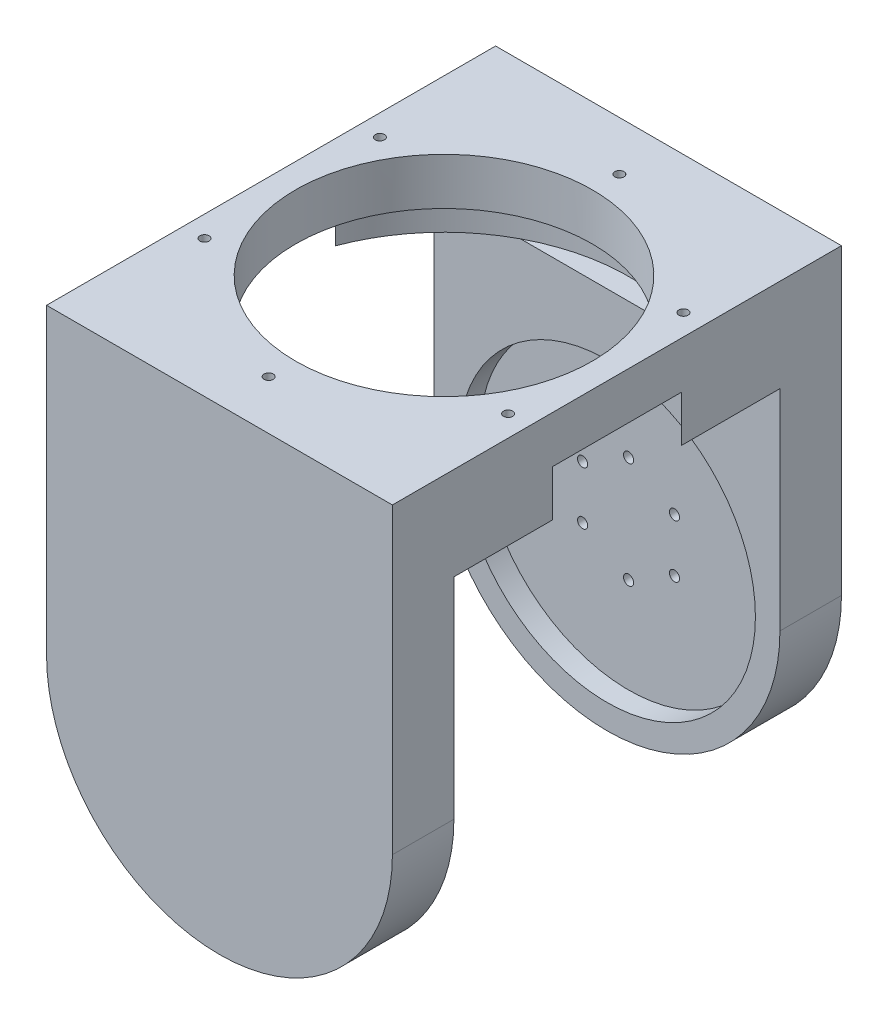
from build123d import *
from build123d.topology import SkipClean

# Parameters (mm, degrees)
SKETCH_1_R                      = 48.25
EXTRUDE_1_DEPTH                 = 20
EXTRUDE_2_DEPTH                 = 66
SKETCH_3_R                      = 48.25
EXTRUDE_3_DEPTH                 = 20
SKETCH_4_R                      = 48.25
CUT_EXTRUDE_1_DEPTH             = 20
SKETCH_5_R                      = 48.25
EXTRUDE_4_DEPTH                 = 20
CUT_EXTRUDE_2_DEPTH             = 20
EXTRUDE_START                   = 20
SKETCH_7_R                      = 48.25
EXTRUDE_5_DEPTH                 = 20
CUT_EXTRUDE_START               = -20
CUT_EXTRUDE_3_DEPTH             = 20
SKETCH_9_R                      = 48.25
EXTRUDE_6_DEPTH                 = 20
EXTRUDE_START_2                 = -20
SKETCH_10_R                     = 48.25
EXTRUDE_7_DEPTH                 = 20
SKETCH_14_R                     = 1.65
EXTRUDE_11_DEPTH                = 10
EXTRUDE_START_3                 = 10
SKETCH_15_R                     = 1.65
EXTRUDE_12_DEPTH                = 10
SKETCH_16_R                     = 27.5
SKETCH_16_R_2                   = 13.104074627
EXTRUDE_13_DEPTH                = 20
CUT_EXTRUDE_4_REACH             = 168.371
SKETCH_17_R                     = 1.65
CUT_EXTRUDE_4_DIRECTION_2_REACH = 168.371
SKETCH_18_R                     = 48.25
CUT_EXTRUDE_5_DEPTH             = 7
CUT_EXTRUDE_6_DEPTH             = 193.775751689
EXTRUDE_START_4                 = 25
SKETCH_20_W                     = 112.445782612
SKETCH_20_H                     = 146
SKETCH_20_R                     = 48.25
EXTRUDE_14_DEPTH                = 25
SKETCH_21_R                     = 60
CUT_EXTRUDE_7_DEPTH             = 15
SKETCH_22_R                     = 1.5
CUT_EXTRUDE_8_DEPTH             = 197.177673484


with BuildPart() as part:
    # 草图1 → 凸台-拉伸1 (new body)
    with BuildSketch(Plane.XY):
        with BuildLine():
            Line((-56.222891306, -36.741813889), (-56.222891306, 36.741813889))
            Line((-56.222891306, 36.741813889), (56.222891306, 36.741813889))
            Line((56.222891306, 36.741813889), (56.222891306, -36.741813889))
            ThreePointArc((56.222891306, -36.741813889), (0, -92.964705195), (-56.222891306, -36.741813889))
        make_face()
        with Locations((0, -36.741813889)):
            Circle(SKETCH_1_R, mode=Mode.SUBTRACT)
    extrude(amount=EXTRUDE_1_DEPTH)

    # 草图2 → 凸台-拉伸2 (add)
    with BuildSketch(Plane.XY.offset(20)):
        Polygon((-43.974846567, 18.741813889), (-56.222891306, 18.741813889), (-56.222891306, 6.493769151), align=None)
        Polygon((56.222891306, 18.741813889), (43.974846567, 18.741813889), (56.222891306, 6.493769151), align=None)
        Polygon((-56.222891306, 36.741813889), (-56.222891306, 18.741813889), (-43.974846567, 18.741813889), (43.974846567, 18.741813889), (56.222891306, 18.741813889), (56.222891306, 36.741813889), align=None)
    extrude(amount=EXTRUDE_2_DEPTH)

    # 草图3 → 凸台-拉伸3 (add)
    with BuildSketch(Plane.XY.offset(86)):
        with BuildLine():
            Line((-56.222891306, 36.741813889), (-56.222891306, -36.741813889))
            ThreePointArc((-56.222891306, -36.741813889), (0, -92.964705195), (56.222891306, -36.741813889))
            Line((56.222891306, -36.741813889), (56.222891306, 36.741813889))
            Line((56.222891306, 36.741813889), (-56.222891306, 36.741813889))
        make_face()
        with Locations((0, -36.741813889)):
            Circle(SKETCH_3_R, mode=Mode.SUBTRACT)
    extrude(amount=EXTRUDE_3_DEPTH)

    # 草图4 → 切除-拉伸1 (cut)
    with BuildSketch(Plane(origin=(0, 36.741813889, 0), x_dir=(1, 0, 0), z_dir=(0, 1, 0))):
        with Locations(Location((0, -53, 0), (0, 0, 270))):
            Circle(SKETCH_4_R)
    extrude(amount=-CUT_EXTRUDE_1_DEPTH, mode=Mode.SUBTRACT)

    # 草图5 → 凸台-拉伸4 (add)
    with BuildSketch(Plane.XY.offset(106)):
        with BuildLine():
            Line((56.222891306, -36.741813889), (56.222891306, 36.741813889))
            Line((56.222891306, 36.741813889), (-56.222891306, 36.741813889))
            Line((-56.222891306, 36.741813889), (-56.222891306, -36.741813889))
            ThreePointArc((-56.222891306, -36.741813889), (0, -92.964705195), (56.222891306, -36.741813889))
        make_face()
        with Locations((0, -36.741813889)):
            Circle(SKETCH_5_R, mode=Mode.SUBTRACT)
    extrude(amount=EXTRUDE_4_DEPTH)

    # 草图6 → 切除-拉伸2 (cut)
    with BuildSketch(Plane(origin=(0, 0, 86), x_dir=(-1, 0, 0), z_dir=(0, 0, -1))):
        with BuildLine():
            Line((35.200319601, 16.741813889), (-35.200319601, 16.741813889))
            Line((-35.200319601, 16.741813889), (-35.200319601, 18.741813889))
            Line((-35.200319601, 18.741813889), (-43.974846567, 18.741813889))
            Line((-43.974846567, 18.741813889), (-56.222891306, 6.493769151))
            Line((-56.222891306, 6.493769151), (-56.222891306, -36.741813889))
            ThreePointArc((-56.222891306, -36.741813889), (0, -92.964705195), (56.222891306, -36.741813889))
            Line((56.222891306, -36.741813889), (56.222891306, 6.493769151))
            Line((56.222891306, 6.493769151), (43.974846567, 18.741813889))
            Line((43.974846567, 18.741813889), (35.200319601, 18.741813889))
            Line((35.200319601, 18.741813889), (35.200319601, 16.741813889))
        make_face()
    extrude(amount=-CUT_EXTRUDE_2_DEPTH, mode=Mode.SUBTRACT)

    # 草图7 → 凸台-拉伸5 (add)
    with SkipClean():  # the faces are left unmerged after this step: merging them gives an invalid solid
        with BuildSketch(Plane(origin=(0, 0, 0), x_dir=(-1, 0, 0), z_dir=(0, 0, -1)).offset(EXTRUDE_START)):
            with BuildLine():
                Line((56.222891306, -36.741813889), (56.222891306, 36.741813889))
                Line((56.222891306, 36.741813889), (-56.222891306, 36.741813889))
                Line((-56.222891306, 36.741813889), (-56.222891306, -36.741813889))
                ThreePointArc((-56.222891306, -36.741813889), (0, -92.964705195), (56.222891306, -36.741813889))
            make_face()
            with Locations((0, -36.741813889)):
                Circle(SKETCH_7_R, mode=Mode.SUBTRACT)
        extrude(amount=-EXTRUDE_5_DEPTH)

    # 草图8 → 切除-拉伸3 (cut)
    with BuildSketch(Plane.XY.offset(20).offset(CUT_EXTRUDE_START)):
        with BuildLine():
            Line((35.200319601, 18.741813889), (35.200319601, 16.741813889))
            Line((35.200319601, 16.741813889), (-35.200319601, 16.741813889))
            Line((-35.200319601, 16.741813889), (-35.200319601, 18.741813889))
            Line((-35.200319601, 18.741813889), (-43.974846567, 18.741813889))
            Line((-43.974846567, 18.741813889), (-56.222891306, 6.493769151))
            Line((-56.222891306, 6.493769151), (-56.222891306, -36.741813889))
            ThreePointArc((-56.222891306, -36.741813889), (0, -92.964705195), (56.222891306, -36.741813889))
            Line((56.222891306, -36.741813889), (56.222891306, 6.493769151))
            Line((56.222891306, 6.493769151), (43.974846567, 18.741813889))
            Line((43.974846567, 18.741813889), (35.200319601, 18.741813889))
        make_face()
    extrude(amount=CUT_EXTRUDE_3_DEPTH, mode=Mode.SUBTRACT)

    # 草图9 → 凸台-拉伸6 (add)
    with BuildSketch(Plane(origin=(0, 0, -20), x_dir=(-1, 0, 0), z_dir=(0, 0, -1))):
        with Locations((0, -36.741813889)):
            Circle(SKETCH_9_R)
    extrude(amount=-EXTRUDE_6_DEPTH)

    # 草图10 → 凸台-拉伸7 (add)
    with BuildSketch(Plane.XY.offset(126).offset(EXTRUDE_START_2)):
        with Locations((0, -36.741813889)):
            Circle(SKETCH_10_R)
    extrude(amount=EXTRUDE_7_DEPTH)

    # 草图14 → 凸台-拉伸11 (add)
    with BuildSketch(Plane.XY):
        with Locations((-14.938938215, -45.366813889)):
            Circle(SKETCH_14_R)
        with Locations((0, -53.991813889)):
            Circle(SKETCH_14_R)
        with Locations((14.938938215, -45.366813889)):
            Circle(SKETCH_14_R)
        with Locations((14.938938215, -28.116813889)):
            Circle(SKETCH_14_R)
        with Locations((0, -19.491813889)):
            Circle(SKETCH_14_R)
        with Locations((-14.938938215, -28.116813889)):
            Circle(SKETCH_14_R)
    extrude(amount=EXTRUDE_11_DEPTH)

    # 草图15 → 凸台-拉伸12 (add)
    with BuildSketch(Plane(origin=(0, 0, 106), x_dir=(-1, 0, 0), z_dir=(0, 0, -1)).offset(EXTRUDE_START_3)):
        with Locations(Location((14.938938215, -28.116813889, 0), (0, 0, 180))):
            Circle(SKETCH_15_R)
        with Locations(Location((14.938938215, -45.366813889, 0), (0, 0, 180))):
            Circle(SKETCH_15_R)
        with Locations(Location((0, -53.991813889, 0), (0, 0, 180))):
            Circle(SKETCH_15_R)
        with Locations(Location((-14.938938215, -45.366813889, 0), (0, 0, 180))):
            Circle(SKETCH_15_R)
        with Locations(Location((-14.938938215, -28.116813889, 0), (0, 0, 180))):
            Circle(SKETCH_15_R)
        with Locations(Location((0, -19.491813889, 0), (0, 0, 180))):
            Circle(SKETCH_15_R)
    extrude(amount=-EXTRUDE_12_DEPTH)

    # 草图16 → 凸台-拉伸13 (add)
    with BuildSketch(Plane(origin=(0, 0, 106), x_dir=(-1, 0, 0), z_dir=(0, 0, -1))):
        with Locations((0, -36.741813889)):
            Circle(SKETCH_16_R)
        with Locations((0, -36.741813889)):
            Circle(SKETCH_16_R_2, mode=Mode.SUBTRACT)
    extrude(amount=EXTRUDE_13_DEPTH)

    # 草图17 → 切除-拉伸4 (cut, up to next)
    with BuildSketch(Plane.XY, mode=Mode.PRIVATE) as cut_extrude_4_sk1:
        with Locations(Location((-14.938938215, -45.366813889, 0), (0, 0, 180))):
            Circle(SKETCH_17_R)
    cut_extrude_4_tool1 = extrude(cut_extrude_4_sk1.sketch, amount=-CUT_EXTRUDE_4_REACH, mode=Mode.PRIVATE) & part.part
    # 草图17 → 切除-拉伸4 (cut, up to next)
    with BuildSketch(Plane.XY, mode=Mode.PRIVATE) as cut_extrude_4_sk2:
        with Locations(Location((0, -53.991813889, 0), (0, 0, 180))):
            Circle(SKETCH_17_R)
    cut_extrude_4_tool2 = extrude(cut_extrude_4_sk2.sketch, amount=-CUT_EXTRUDE_4_REACH, mode=Mode.PRIVATE) & part.part
    # 草图17 → 切除-拉伸4 (cut, up to next)
    with BuildSketch(Plane.XY, mode=Mode.PRIVATE) as cut_extrude_4_sk3:
        with Locations(Location((14.938938215, -45.366813889, 0), (0, 0, 180))):
            Circle(SKETCH_17_R)
    cut_extrude_4_tool3 = extrude(cut_extrude_4_sk3.sketch, amount=-CUT_EXTRUDE_4_REACH, mode=Mode.PRIVATE) & part.part
    # 草图17 → 切除-拉伸4 (cut, up to next)
    with BuildSketch(Plane.XY, mode=Mode.PRIVATE) as cut_extrude_4_sk4:
        with Locations(Location((14.938938215, -28.116813889, 0), (0, 0, 180))):
            Circle(SKETCH_17_R)
    cut_extrude_4_tool4 = extrude(cut_extrude_4_sk4.sketch, amount=-CUT_EXTRUDE_4_REACH, mode=Mode.PRIVATE) & part.part
    # 草图17 → 切除-拉伸4 (cut, up to next)
    with BuildSketch(Plane.XY, mode=Mode.PRIVATE) as cut_extrude_4_sk5:
        with Locations(Location((0, -19.491813889, 0), (0, 0, 180))):
            Circle(SKETCH_17_R)
    cut_extrude_4_tool5 = extrude(cut_extrude_4_sk5.sketch, amount=-CUT_EXTRUDE_4_REACH, mode=Mode.PRIVATE) & part.part
    # 草图17 → 切除-拉伸4 (cut, up to next)
    with BuildSketch(Plane.XY, mode=Mode.PRIVATE) as cut_extrude_4_sk6:
        with Locations(Location((-14.938938215, -28.116813889, 0), (0, 0, 180))):
            Circle(SKETCH_17_R)
    cut_extrude_4_tool6 = extrude(cut_extrude_4_sk6.sketch, amount=-CUT_EXTRUDE_4_REACH, mode=Mode.PRIVATE) & part.part
    add(cut_extrude_4_tool1.solids().sort_by_distance((-14.938938, -45.366814, 0))[0], mode=Mode.SUBTRACT)
    add(cut_extrude_4_tool2.solids().sort_by_distance((0, -53.991814, 0))[0], mode=Mode.SUBTRACT)
    add(cut_extrude_4_tool3.solids().sort_by_distance((14.938938, -45.366814, 0))[0], mode=Mode.SUBTRACT)
    add(cut_extrude_4_tool4.solids().sort_by_distance((14.938938, -28.116814, 0))[0], mode=Mode.SUBTRACT)
    add(cut_extrude_4_tool5.solids().sort_by_distance((0, -19.491814, 0))[0], mode=Mode.SUBTRACT)
    add(cut_extrude_4_tool6.solids().sort_by_distance((-14.938938, -28.116814, 0))[0], mode=Mode.SUBTRACT)

    # 草图17 → 切除-拉伸4 direction 2 (cut, up to next)
    with BuildSketch(Plane.XY, mode=Mode.PRIVATE) as cut_extrude_4_direction_2_sk1:
        with Locations(Location((-14.938938215, -45.366813889, 0), (0, 0, 180))):
            Circle(SKETCH_17_R)
    cut_extrude_4_direction_2_tool1 = extrude(cut_extrude_4_direction_2_sk1.sketch, amount=CUT_EXTRUDE_4_DIRECTION_2_REACH, mode=Mode.PRIVATE) & part.part
    # 草图17 → 切除-拉伸4 direction 2 (cut, up to next)
    with BuildSketch(Plane.XY, mode=Mode.PRIVATE) as cut_extrude_4_direction_2_sk2:
        with Locations(Location((0, -53.991813889, 0), (0, 0, 180))):
            Circle(SKETCH_17_R)
    cut_extrude_4_direction_2_tool2 = extrude(cut_extrude_4_direction_2_sk2.sketch, amount=CUT_EXTRUDE_4_DIRECTION_2_REACH, mode=Mode.PRIVATE) & part.part
    # 草图17 → 切除-拉伸4 direction 2 (cut, up to next)
    with BuildSketch(Plane.XY, mode=Mode.PRIVATE) as cut_extrude_4_direction_2_sk3:
        with Locations(Location((14.938938215, -45.366813889, 0), (0, 0, 180))):
            Circle(SKETCH_17_R)
    cut_extrude_4_direction_2_tool3 = extrude(cut_extrude_4_direction_2_sk3.sketch, amount=CUT_EXTRUDE_4_DIRECTION_2_REACH, mode=Mode.PRIVATE) & part.part
    # 草图17 → 切除-拉伸4 direction 2 (cut, up to next)
    with BuildSketch(Plane.XY, mode=Mode.PRIVATE) as cut_extrude_4_direction_2_sk4:
        with Locations(Location((14.938938215, -28.116813889, 0), (0, 0, 180))):
            Circle(SKETCH_17_R)
    cut_extrude_4_direction_2_tool4 = extrude(cut_extrude_4_direction_2_sk4.sketch, amount=CUT_EXTRUDE_4_DIRECTION_2_REACH, mode=Mode.PRIVATE) & part.part
    # 草图17 → 切除-拉伸4 direction 2 (cut, up to next)
    with BuildSketch(Plane.XY, mode=Mode.PRIVATE) as cut_extrude_4_direction_2_sk5:
        with Locations(Location((0, -19.491813889, 0), (0, 0, 180))):
            Circle(SKETCH_17_R)
    cut_extrude_4_direction_2_tool5 = extrude(cut_extrude_4_direction_2_sk5.sketch, amount=CUT_EXTRUDE_4_DIRECTION_2_REACH, mode=Mode.PRIVATE) & part.part
    # 草图17 → 切除-拉伸4 direction 2 (cut, up to next)
    with BuildSketch(Plane.XY, mode=Mode.PRIVATE) as cut_extrude_4_direction_2_sk6:
        with Locations(Location((-14.938938215, -28.116813889, 0), (0, 0, 180))):
            Circle(SKETCH_17_R)
    cut_extrude_4_direction_2_tool6 = extrude(cut_extrude_4_direction_2_sk6.sketch, amount=CUT_EXTRUDE_4_DIRECTION_2_REACH, mode=Mode.PRIVATE) & part.part
    add(cut_extrude_4_direction_2_tool1.solids().sort_by_distance((-14.938938, -45.366814, 0))[0], mode=Mode.SUBTRACT)
    add(cut_extrude_4_direction_2_tool2.solids().sort_by_distance((0, -53.991814, 0))[0], mode=Mode.SUBTRACT)
    add(cut_extrude_4_direction_2_tool3.solids().sort_by_distance((14.938938, -45.366814, 0))[0], mode=Mode.SUBTRACT)
    add(cut_extrude_4_direction_2_tool4.solids().sort_by_distance((14.938938, -28.116814, 0))[0], mode=Mode.SUBTRACT)
    add(cut_extrude_4_direction_2_tool5.solids().sort_by_distance((0, -19.491814, 0))[0], mode=Mode.SUBTRACT)
    add(cut_extrude_4_direction_2_tool6.solids().sort_by_distance((-14.938938, -28.116814, 0))[0], mode=Mode.SUBTRACT)

    # 草图18 → 切除-拉伸5 (cut)
    with BuildSketch(Plane.XY):
        with Locations((0, -36.741813889)):
            Circle(SKETCH_18_R)
    extrude(amount=-CUT_EXTRUDE_5_DEPTH, mode=Mode.SUBTRACT)

    # 草图19 → 切除-拉伸6 (cut, through all)
    with BuildSketch(Plane.ZY.offset(56.222891306)):
        Polygon((106, 6.493769151), (106, 18.741813889), (106, 31.493769151), (0, 31.493769151), (0, 18.741813889), (0, 6.493769151), align=None)
    extrude(amount=-CUT_EXTRUDE_6_DEPTH, mode=Mode.SUBTRACT)

    # 草图20 → 凸台-拉伸14 (add)
    with BuildSketch(Plane(origin=(0, 36.741813889, 0), x_dir=(1, 0, 0), z_dir=(0, 1, 0)).offset(EXTRUDE_START_4)):
        with Locations((0, -53)):
            Rectangle(SKETCH_20_W, SKETCH_20_H)
        with Locations(Location((0, -53, 0), (0, 0, 270))):
            Circle(SKETCH_20_R, mode=Mode.SUBTRACT)
    extrude(amount=-EXTRUDE_14_DEPTH)

    # 草图21 → 切除-拉伸7 (cut)
    with BuildSketch(Plane.XZ.offset(-31.493769151)):
        with Locations((0, 53)):
            Circle(SKETCH_21_R)
    extrude(amount=-CUT_EXTRUDE_7_DEPTH, mode=Mode.SUBTRACT)

    # 草图22 → 切除-拉伸8 (cut, through all)
    with BuildSketch(Plane.XZ.offset(-46.493769151)):
        with Locations(Location((0, 110, 0), (0, 0, 270))):
            Circle(SKETCH_22_R)
        with Locations(Location((49.363448016, 81.5, 0), (0, 0, 270))):
            Circle(SKETCH_22_R)
        with Locations(Location((49.363448016, 24.5, 0), (0, 0, 270))):
            Circle(SKETCH_22_R)
        with Locations(Location((0, -4, 0), (0, 0, 270))):
            Circle(SKETCH_22_R)
        with Locations(Location((-49.363448016, 24.5, 0), (0, 0, 270))):
            Circle(SKETCH_22_R)
        with Locations(Location((-49.363448016, 81.5, 0), (0, 0, 270))):
            Circle(SKETCH_22_R)
    extrude(amount=-CUT_EXTRUDE_8_DEPTH, mode=Mode.SUBTRACT)


solid = part.part
